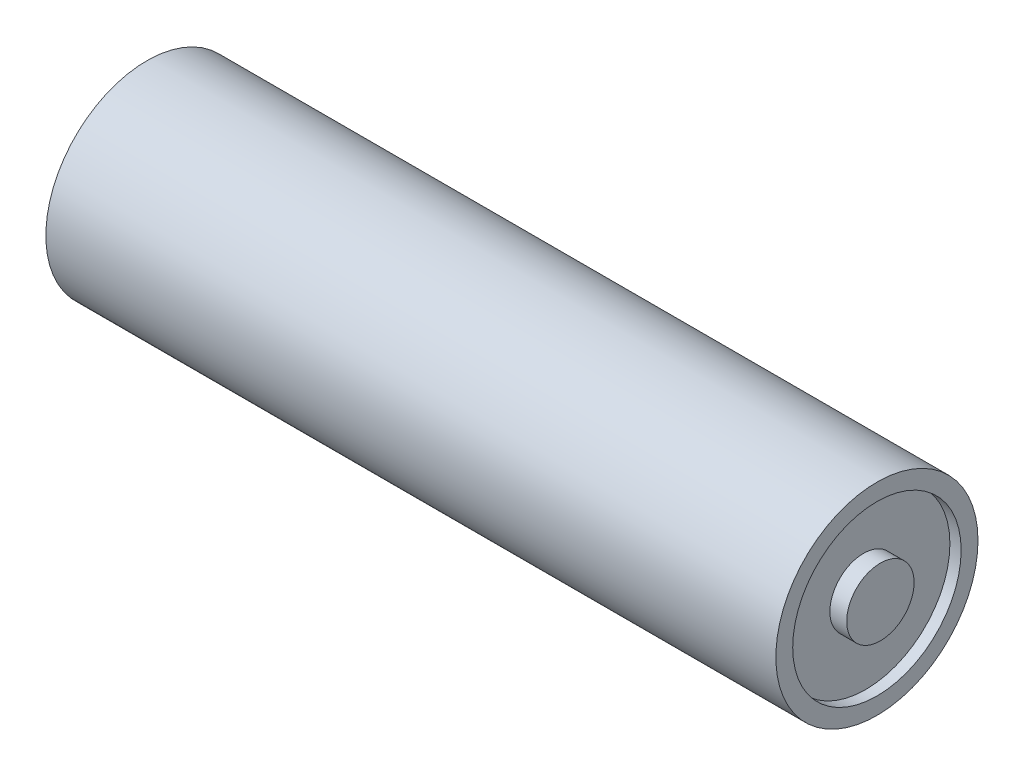
from build123d import *

# Parameters (mm, degrees)
SKETCH_1_R          = 9
EXTRUDE_1_DEPTH     = 65
SKETCH_2_R          = 7.5
CUT_EXTRUDE_1_DEPTH = 1
SKETCH_3_R          = 3
EXTRUDE_2_DEPTH     = 1.5


with BuildPart() as part:
    # Эскиз1 → Бобышка-Вытянуть1 (new body)
    with BuildSketch(Plane(origin=(0, 0, 0), x_dir=(0, 0, -1), z_dir=(1, 0, 0))):
        Circle(SKETCH_1_R)
    extrude(amount=EXTRUDE_1_DEPTH)

    # Эскиз2 → Вырез-Вытянуть1 (cut)
    with BuildSketch(Plane(origin=(65, 0, 0), x_dir=(0, 0, -1), z_dir=(1, 0, 0))):
        Circle(SKETCH_2_R)
    extrude(amount=-CUT_EXTRUDE_1_DEPTH, mode=Mode.SUBTRACT)

    # Эскиз3 → Бобышка-Вытянуть2 (add)
    with BuildSketch(Plane(origin=(64, 0, 0), x_dir=(0, 0, -1), z_dir=(1, 0, 0))):
        with Locations((-0.192251795, 0.103684868)):
            Circle(SKETCH_3_R)
    extrude(amount=EXTRUDE_2_DEPTH)


solid = part.part
